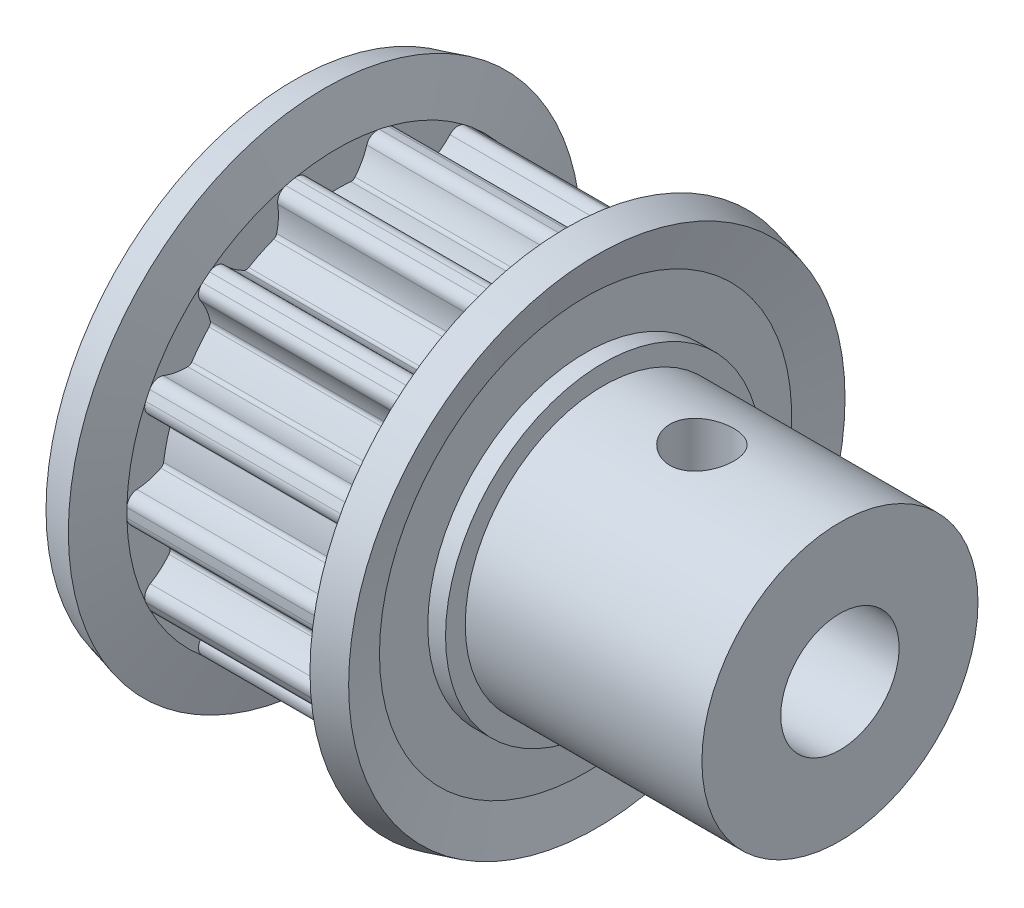
from build123d import *

# Parameters (mm, degrees)
SKETCH2_W           = 28
SKETCH2_H           = 3
CUT_EXTRUDE1_DEPTH  = 11
CUT_EXTRUDE2_DEPTH  = 11
CUT_EXTRUDE3_DEPTH  = 11
CUT_EXTRUDE4_DEPTH  = 11
CUT_EXTRUDE5_DEPTH  = 11
CUT_EXTRUDE6_DEPTH  = 11
CUT_EXTRUDE7_DEPTH  = 11
CUT_EXTRUDE8_DEPTH  = 11
CUT_EXTRUDE9_DEPTH  = 11
CUT_EXTRUDE10_DEPTH = 11
CUT_EXTRUDE11_DEPTH = 11
CUT_EXTRUDE12_DEPTH = 11
CUT_EXTRUDE13_DEPTH = 11
CUT_EXTRUDE14_DEPTH = 11
SKETCH17_W          = 1.621
SKETCH17_H          = 7


with BuildPart() as part:
    # Sketch1 → Revolve1 (revolve)
    with BuildSketch(Plane.XY, mode=Mode.PRIVATE) as revolve1_sk:
        Polygon((0, 0), (0, 8), (0.9, 8), (0.9, 10.449356004), (0.327517568, 12.585889528), (1.87299889, 13), (2.5, 10.66), (13.5, 10.66), (14.12700111, 13), (15.672482432, 12.585889528), (15.1, 10.449356004), (15.1, 8), (16, 8), (16, 7), (28, 7), (28, 0), align=None)
    revolve(revolve1_sk.sketch.rotate(Axis((28, 0, 0), (-1, 0, 0)), 270), axis=Axis((28, 0, 0), (-1, 0, 0)))

    # Sketch2 → Cut-Revolve1 (revolve, cut)
    with BuildSketch(Plane.XY, mode=Mode.PRIVATE) as cut_revolve1_sk:
        with Locations((14, 1.5)):
            Rectangle(SKETCH2_W, SKETCH2_H)
    revolve(cut_revolve1_sk.sketch.rotate(Axis((28, 0, 0), (-1, 0, 0)), 270), axis=Axis((28, 0, 0), (-1, 0, 0)), mode=Mode.SUBTRACT)

    # Sketch3 → Cut-Extrude1 (cut)
    with BuildSketch(Plane(origin=(2.5, 0, 0), x_dir=(0, 0, -1), z_dir=(1, 0, 0))):
        with BuildLine():
            Line((2.143757384, 10.442217402), (2.143757384, 14.213333333))
            Line((2.143757384, 14.213333333), (-2.143757384, 14.213333333))
            Line((-2.143757384, 14.213333333), (-2.143757384, 10.442217402))
            ThreePointArc((-2.143757384, 10.442217402), (-1.752297901, 10.376340369), (-1.507142158, 10.064124142))
            ThreePointArc((-1.507142158, 10.064124142), (-1.264997462, 9.48021312), (-0.915185109, 8.953698683))
            ThreePointArc((-0.915185109, 8.953698683), (-0.819634833, 8.881657075), (-0.701549243, 8.862275592))
            ThreePointArc((-0.701549243, 8.862275592), (0, 8.89), (0.701549243, 8.862275592))
            ThreePointArc((0.701549243, 8.862275592), (0.819634845, 8.88165708), (0.915185126, 8.953698703))
            ThreePointArc((0.915185126, 8.953698703), (1.264997468, 9.480213132), (1.507142158, 10.064124142))
            ThreePointArc((1.507142158, 10.064124142), (1.752297901, 10.376340369), (2.143757384, 10.442217402))
        make_face()
    extrude(amount=CUT_EXTRUDE1_DEPTH, mode=Mode.SUBTRACT)

    # Sketch4 → Cut-Extrude2 (cut)
    with BuildSketch(Plane(origin=(2.5, 0, 0), x_dir=(0, 0, -1), z_dir=(1, 0, 0))):
        with BuildLine():
            Line((6.462166994, 8.477971322), (8.098392875, 11.875629373))
            Line((8.098392875, 11.875629373), (4.235475549, 13.735912312))
            Line((4.235475549, 13.735912312), (2.599249668, 10.338254261))
            ThreePointArc((2.599249668, 10.338254261), (2.923359502, 10.1090532), (3.00877165, 9.721387009))
            ThreePointArc((3.00877165, 9.721387009), (2.973586985, 9.090238711), (3.060310971, 8.464087703))
            ThreePointArc((3.060310971, 8.464087703), (3.115141114, 8.357722746), (3.213123244, 8.289025215))
            ThreePointArc((3.213123244, 8.289025215), (3.857226441, 8.009613236), (4.477271298, 7.680243598))
            ThreePointArc((4.477271298, 7.680243598), (4.592072062, 7.646470294), (4.709417579, 7.66991984))
            ThreePointArc((4.709417579, 7.66991984), (5.253033658, 7.992515061), (5.724547977, 8.413538059))
            ThreePointArc((5.724547977, 8.413538059), (6.080891213, 8.58846607), (6.462166994, 8.477971322))
        make_face()
    extrude(amount=CUT_EXTRUDE2_DEPTH, mode=Mode.SUBTRACT)

    # Sketch5 → Cut-Extrude3 (cut)
    with BuildSketch(Plane(origin=(2.5, 0, 0), x_dir=(0, 0, -1), z_dir=(1, 0, 0))):
        with BuildLine():
            Line((9.500665178, 4.834559046), (12.449042337, 7.18581137))
            Line((12.449042337, 7.18581137), (9.775820604, 10.537925397))
            Line((9.775820604, 10.537925397), (6.827443445, 8.186673073))
            ThreePointArc((6.827443445, 8.186673073), (7.020009702, 7.839544066), (6.928761332, 7.453209955))
            ThreePointArc((6.928761332, 7.453209955), (6.623216061, 6.899831041), (6.429674932, 6.298060348))
            ThreePointArc((6.429674932, 6.298060348), (6.432925158, 6.178438927), (6.491397265, 6.074031737))
            ThreePointArc((6.491397265, 6.074031737), (6.950481879, 5.542824339), (7.366214862, 4.977045168))
            ThreePointArc((7.366214862, 4.977045168), (7.454993089, 4.896806287), (7.570892123, 4.867019286))
            ThreePointArc((7.570892123, 4.867019286), (8.200642108, 4.921801361), (8.808136863, 5.096547579))
            ThreePointArc((8.808136863, 5.096547579), (9.205089444, 5.099540735), (9.500665178, 4.834559046))
        make_face()
    extrude(amount=CUT_EXTRUDE3_DEPTH, mode=Mode.SUBTRACT)

    # Sketch6 → Cut-Extrude4 (cut)
    with BuildSketch(Plane(origin=(2.5, 0, 0), x_dir=(0, 0, -1), z_dir=(1, 0, 0))):
        with BuildLine():
            Line((10.657440106, 0.233603059), (14.334006287, 1.072755298))
            Line((14.334006287, 1.072755298), (13.379944497, 5.252773118))
            Line((13.379944497, 5.252773118), (9.703378315, 4.413620879))
            ThreePointArc((9.703378315, 4.413620879), (9.726260886, 4.017317084), (9.476424857, 3.708833261))
            ThreePointArc((9.476424857, 3.708833261), (8.961035967, 3.342827212), (8.525562918, 2.884624901))
            ThreePointArc((8.525562918, 2.884624901), (8.476589481, 2.775439504), (8.483970447, 2.65600178))
            ThreePointArc((8.483970447, 2.65600178), (8.667109139, 1.978211103), (8.796189232, 1.288081903))
            ThreePointArc((8.796189232, 1.288081903), (8.841361305, 1.17726974), (8.932858632, 1.100145874))
            ThreePointArc((8.932858632, 1.100145874), (9.524012814, 0.876264539), (10.147166218, 0.770123346))
            ThreePointArc((10.147166218, 0.770123346), (10.506106817, 0.600588816), (10.657440106, 0.233603059))
        make_face()
    extrude(amount=CUT_EXTRUDE4_DEPTH, mode=Mode.SUBTRACT)

    # Sketch7 → Cut-Extrude5 (cut)
    with BuildSketch(Plane(origin=(2.5, 0, 0), x_dir=(0, 0, -1), z_dir=(1, 0, 0))):
        with BuildLine():
            Line((9.703378315, -4.413620879), (13.379944497, -5.252773118))
            Line((13.379944497, -5.252773118), (14.334006287, -1.072755298))
            Line((14.334006287, -1.072755298), (10.657440106, -0.233603059))
            ThreePointArc((10.657440106, -0.233603059), (10.506106817, -0.600588816), (10.147166218, -0.770123346))
            ThreePointArc((10.147166218, -0.770123346), (9.524012801, -0.876264543), (8.932858608, -1.100145885))
            ThreePointArc((8.932858608, -1.100145885), (8.841361298, -1.177269751), (8.796189232, -1.288081903))
            ThreePointArc((8.796189232, -1.288081903), (8.667109139, -1.978211103), (8.483970447, -2.65600178))
            ThreePointArc((8.483970447, -2.65600178), (8.476589483, -2.775439517), (8.525562934, -2.884624922))
            ThreePointArc((8.525562934, -2.884624922), (8.961035977, -3.342827221), (9.476424857, -3.708833261))
            ThreePointArc((9.476424857, -3.708833261), (9.726260886, -4.017317084), (9.703378315, -4.413620879))
        make_face()
    extrude(amount=CUT_EXTRUDE5_DEPTH, mode=Mode.SUBTRACT)

    # Sketch8 → Cut-Extrude6 (cut)
    with BuildSketch(Plane(origin=(2.5, 0, 0), x_dir=(0, 0, -1), z_dir=(1, 0, 0))):
        with BuildLine():
            Line((6.827443445, -8.186673073), (9.775820604, -10.537925397))
            Line((9.775820604, -10.537925397), (12.449042337, -7.18581137))
            Line((12.449042337, -7.18581137), (9.500665178, -4.834559046))
            ThreePointArc((9.500665178, -4.834559046), (9.205089444, -5.099540735), (8.808136863, -5.096547579))
            ThreePointArc((8.808136863, -5.096547579), (8.200642095, -4.921801358), (7.570892097, -4.867019287))
            ThreePointArc((7.570892097, -4.867019287), (7.454993078, -4.896806294), (7.366214862, -4.977045168))
            ThreePointArc((7.366214862, -4.977045168), (6.950481879, -5.542824339), (6.491397265, -6.074031737))
            ThreePointArc((6.491397265, -6.074031737), (6.432925155, -6.178438939), (6.429674938, -6.298060374))
            ThreePointArc((6.429674938, -6.298060374), (6.623216066, -6.899831053), (6.928761332, -7.453209955))
            ThreePointArc((6.928761332, -7.453209955), (7.020009702, -7.839544066), (6.827443445, -8.186673073))
        make_face()
    extrude(amount=CUT_EXTRUDE6_DEPTH, mode=Mode.SUBTRACT)

    # Sketch9 → Cut-Extrude7 (cut)
    with BuildSketch(Plane(origin=(2.5, 0, 0), x_dir=(0, 0, -1), z_dir=(1, 0, 0))):
        with BuildLine():
            Line((2.599249668, -10.338254261), (4.235475549, -13.735912312))
            Line((4.235475549, -13.735912312), (8.098392875, -11.875629373))
            Line((8.098392875, -11.875629373), (6.462166994, -8.477971322))
            ThreePointArc((6.462166994, -8.477971322), (6.080891213, -8.58846607), (5.724547977, -8.413538059))
            ThreePointArc((5.724547977, -8.413538059), (5.253033648, -7.992515053), (4.709417555, -7.669919828))
            ThreePointArc((4.709417555, -7.669919828), (4.592072049, -7.646470294), (4.477271298, -7.680243598))
            ThreePointArc((4.477271298, -7.680243598), (3.857226441, -8.009613236), (3.213123244, -8.289025215))
            ThreePointArc((3.213123244, -8.289025215), (3.115141105, -8.357722756), (3.060310965, -8.464087729))
            ThreePointArc((3.060310965, -8.464087729), (2.973586984, -9.090238724), (3.00877165, -9.721387009))
            ThreePointArc((3.00877165, -9.721387009), (2.923359502, -10.1090532), (2.599249668, -10.338254261))
        make_face()
    extrude(amount=CUT_EXTRUDE7_DEPTH, mode=Mode.SUBTRACT)

    # Sketch10 → Cut-Extrude8 (cut)
    with BuildSketch(Plane(origin=(2.5, 0, 0), x_dir=(0, 0, -1), z_dir=(1, 0, 0))):
        with BuildLine():
            Line((-2.143757384, -10.442217402), (-2.143757384, -14.213333333))
            Line((-2.143757384, -14.213333333), (2.143757384, -14.213333333))
            Line((2.143757384, -14.213333333), (2.143757384, -10.442217402))
            ThreePointArc((2.143757384, -10.442217402), (1.752297901, -10.376340369), (1.507142158, -10.064124142))
            ThreePointArc((1.507142158, -10.064124142), (1.264997462, -9.48021312), (0.915185109, -8.953698683))
            ThreePointArc((0.915185109, -8.953698683), (0.819634833, -8.881657075), (0.701549243, -8.862275592))
            ThreePointArc((0.701549243, -8.862275592), (0, -8.89), (-0.701549243, -8.862275592))
            ThreePointArc((-0.701549243, -8.862275592), (-0.819634845, -8.88165708), (-0.915185126, -8.953698703))
            ThreePointArc((-0.915185126, -8.953698703), (-1.264997468, -9.480213132), (-1.507142158, -10.064124142))
            ThreePointArc((-1.507142158, -10.064124142), (-1.752297901, -10.376340369), (-2.143757384, -10.442217402))
        make_face()
    extrude(amount=CUT_EXTRUDE8_DEPTH, mode=Mode.SUBTRACT)

    # Sketch11 → Cut-Extrude9 (cut)
    with BuildSketch(Plane(origin=(2.5, 0, 0), x_dir=(0, 0, -1), z_dir=(1, 0, 0))):
        with BuildLine():
            Line((-6.462166994, -8.477971322), (-8.098392875, -11.875629373))
            Line((-8.098392875, -11.875629373), (-4.235475549, -13.735912312))
            Line((-4.235475549, -13.735912312), (-2.599249668, -10.338254261))
            ThreePointArc((-2.599249668, -10.338254261), (-2.923359502, -10.1090532), (-3.00877165, -9.721387009))
            ThreePointArc((-3.00877165, -9.721387009), (-2.973586985, -9.090238711), (-3.060310971, -8.464087703))
            ThreePointArc((-3.060310971, -8.464087703), (-3.115141114, -8.357722746), (-3.213123244, -8.289025215))
            ThreePointArc((-3.213123244, -8.289025215), (-3.857226441, -8.009613236), (-4.477271298, -7.680243598))
            ThreePointArc((-4.477271298, -7.680243598), (-4.592072062, -7.646470294), (-4.709417579, -7.66991984))
            ThreePointArc((-4.709417579, -7.66991984), (-5.253033658, -7.992515061), (-5.724547977, -8.413538059))
            ThreePointArc((-5.724547977, -8.413538059), (-6.080891213, -8.58846607), (-6.462166994, -8.477971322))
        make_face()
    extrude(amount=CUT_EXTRUDE9_DEPTH, mode=Mode.SUBTRACT)

    # Sketch12 → Cut-Extrude10 (cut)
    with BuildSketch(Plane(origin=(2.5, 0, 0), x_dir=(0, 0, -1), z_dir=(1, 0, 0))):
        with BuildLine():
            Line((-9.500665178, -4.834559046), (-12.449042337, -7.18581137))
            Line((-12.449042337, -7.18581137), (-9.775820604, -10.537925397))
            Line((-9.775820604, -10.537925397), (-6.827443445, -8.186673073))
            ThreePointArc((-6.827443445, -8.186673073), (-7.020009702, -7.839544066), (-6.928761332, -7.453209955))
            ThreePointArc((-6.928761332, -7.453209955), (-6.623216061, -6.899831041), (-6.429674932, -6.298060348))
            ThreePointArc((-6.429674932, -6.298060348), (-6.432925158, -6.178438927), (-6.491397265, -6.074031737))
            ThreePointArc((-6.491397265, -6.074031737), (-6.950481879, -5.542824339), (-7.366214862, -4.977045168))
            ThreePointArc((-7.366214862, -4.977045168), (-7.454993089, -4.896806287), (-7.570892123, -4.867019286))
            ThreePointArc((-7.570892123, -4.867019286), (-8.200642108, -4.921801361), (-8.808136863, -5.096547579))
            ThreePointArc((-8.808136863, -5.096547579), (-9.205089444, -5.099540735), (-9.500665178, -4.834559046))
        make_face()
    extrude(amount=CUT_EXTRUDE10_DEPTH, mode=Mode.SUBTRACT)

    # Sketch13 → Cut-Extrude11 (cut)
    with BuildSketch(Plane(origin=(2.5, 0, 0), x_dir=(0, 0, -1), z_dir=(1, 0, 0))):
        with BuildLine():
            Line((-10.657440106, -0.233603059), (-14.334006287, -1.072755298))
            Line((-14.334006287, -1.072755298), (-13.379944497, -5.252773118))
            Line((-13.379944497, -5.252773118), (-9.703378315, -4.413620879))
            ThreePointArc((-9.703378315, -4.413620879), (-9.726260886, -4.017317084), (-9.476424857, -3.708833261))
            ThreePointArc((-9.476424857, -3.708833261), (-8.961035967, -3.342827212), (-8.525562918, -2.884624901))
            ThreePointArc((-8.525562918, -2.884624901), (-8.476589481, -2.775439504), (-8.483970447, -2.65600178))
            ThreePointArc((-8.483970447, -2.65600178), (-8.667109139, -1.978211103), (-8.796189232, -1.288081903))
            ThreePointArc((-8.796189232, -1.288081903), (-8.841361305, -1.17726974), (-8.932858632, -1.100145874))
            ThreePointArc((-8.932858632, -1.100145874), (-9.524012814, -0.876264539), (-10.147166218, -0.770123346))
            ThreePointArc((-10.147166218, -0.770123346), (-10.506106817, -0.600588816), (-10.657440106, -0.233603059))
        make_face()
    extrude(amount=CUT_EXTRUDE11_DEPTH, mode=Mode.SUBTRACT)

    # Sketch14 → Cut-Extrude12 (cut)
    with BuildSketch(Plane(origin=(2.5, 0, 0), x_dir=(0, 0, -1), z_dir=(1, 0, 0))):
        with BuildLine():
            Line((-9.703378315, 4.413620879), (-13.379944497, 5.252773118))
            Line((-13.379944497, 5.252773118), (-14.334006287, 1.072755298))
            Line((-14.334006287, 1.072755298), (-10.657440106, 0.233603059))
            ThreePointArc((-10.657440106, 0.233603059), (-10.506106817, 0.600588816), (-10.147166218, 0.770123346))
            ThreePointArc((-10.147166218, 0.770123346), (-9.524012801, 0.876264543), (-8.932858608, 1.100145885))
            ThreePointArc((-8.932858608, 1.100145885), (-8.841361298, 1.177269751), (-8.796189232, 1.288081903))
            ThreePointArc((-8.796189232, 1.288081903), (-8.667109139, 1.978211103), (-8.483970447, 2.65600178))
            ThreePointArc((-8.483970447, 2.65600178), (-8.476589483, 2.775439517), (-8.525562934, 2.884624922))
            ThreePointArc((-8.525562934, 2.884624922), (-8.961035977, 3.342827221), (-9.476424857, 3.708833261))
            ThreePointArc((-9.476424857, 3.708833261), (-9.726260886, 4.017317084), (-9.703378315, 4.413620879))
        make_face()
    extrude(amount=CUT_EXTRUDE12_DEPTH, mode=Mode.SUBTRACT)

    # Sketch15 → Cut-Extrude13 (cut)
    with BuildSketch(Plane(origin=(2.5, 0, 0), x_dir=(0, 0, -1), z_dir=(1, 0, 0))):
        with BuildLine():
            Line((-6.827443445, 8.186673073), (-9.775820604, 10.537925397))
            Line((-9.775820604, 10.537925397), (-12.449042337, 7.18581137))
            Line((-12.449042337, 7.18581137), (-9.500665178, 4.834559046))
            ThreePointArc((-9.500665178, 4.834559046), (-9.205089444, 5.099540735), (-8.808136863, 5.096547579))
            ThreePointArc((-8.808136863, 5.096547579), (-8.200642095, 4.921801358), (-7.570892097, 4.867019287))
            ThreePointArc((-7.570892097, 4.867019287), (-7.454993078, 4.896806294), (-7.366214862, 4.977045168))
            ThreePointArc((-7.366214862, 4.977045168), (-6.950481879, 5.542824339), (-6.491397265, 6.074031737))
            ThreePointArc((-6.491397265, 6.074031737), (-6.432925155, 6.178438939), (-6.429674938, 6.298060374))
            ThreePointArc((-6.429674938, 6.298060374), (-6.623216066, 6.899831053), (-6.928761332, 7.453209955))
            ThreePointArc((-6.928761332, 7.453209955), (-7.020009702, 7.839544066), (-6.827443445, 8.186673073))
        make_face()
    extrude(amount=CUT_EXTRUDE13_DEPTH, mode=Mode.SUBTRACT)

    # Sketch16 → Cut-Extrude14 (cut)
    with BuildSketch(Plane(origin=(2.5, 0, 0), x_dir=(0, 0, -1), z_dir=(1, 0, 0))):
        with BuildLine():
            Line((-2.599249668, 10.338254261), (-4.235475549, 13.735912312))
            Line((-4.235475549, 13.735912312), (-8.098392875, 11.875629373))
            Line((-8.098392875, 11.875629373), (-6.462166994, 8.477971322))
            ThreePointArc((-6.462166994, 8.477971322), (-6.080891213, 8.58846607), (-5.724547977, 8.413538059))
            ThreePointArc((-5.724547977, 8.413538059), (-5.253033648, 7.992515053), (-4.709417555, 7.669919828))
            ThreePointArc((-4.709417555, 7.669919828), (-4.592072049, 7.646470294), (-4.477271298, 7.680243598))
            ThreePointArc((-4.477271298, 7.680243598), (-3.857226441, 8.009613236), (-3.213123244, 8.289025215))
            ThreePointArc((-3.213123244, 8.289025215), (-3.115141105, 8.357722756), (-3.060310965, 8.464087729))
            ThreePointArc((-3.060310965, 8.464087729), (-2.973586984, 9.090238724), (-3.00877165, 9.721387009))
            ThreePointArc((-3.00877165, 9.721387009), (-2.923359502, 10.1090532), (-2.599249668, 10.338254261))
        make_face()
    extrude(amount=CUT_EXTRUDE14_DEPTH, mode=Mode.SUBTRACT)

    # Sketch17 → Cut-Revolve2 (revolve, cut)
    with BuildSketch(Plane(origin=(21, 0, 0), x_dir=(0, 0, -1), z_dir=(1, 0, 0)), mode=Mode.PRIVATE) as cut_revolve2_sk:
        with Locations((0.8105, 3.5)):
            Rectangle(SKETCH17_W, SKETCH17_H)
    revolve(cut_revolve2_sk.sketch.rotate(Axis((21, 0, 0), (0, 1, 0)), 180), axis=Axis((21, 0, 0), (0, 1, 0)), mode=Mode.SUBTRACT)

    # Sketch18 → Cut-Revolve3 (revolve, cut)
    with BuildSketch(Plane(origin=(21, 0, 0), x_dir=(0, 0, -1), z_dir=(1, 0, 0)), mode=Mode.PRIVATE) as cut_revolve3_sk:
        Polygon((6.062177826, -3.5), (5.251677826, -4.90382718), (-0.8105, -1.40382718), (0, 0), align=None)
    revolve(cut_revolve3_sk.sketch.rotate(Axis((21, 0, 0), (0, -0.4999999999999982, -0.8660254037844397)), 180), axis=Axis((21, 0, 0), (0, -0.4999999999999982, -0.8660254037844397)), mode=Mode.SUBTRACT)


solid = part.part
